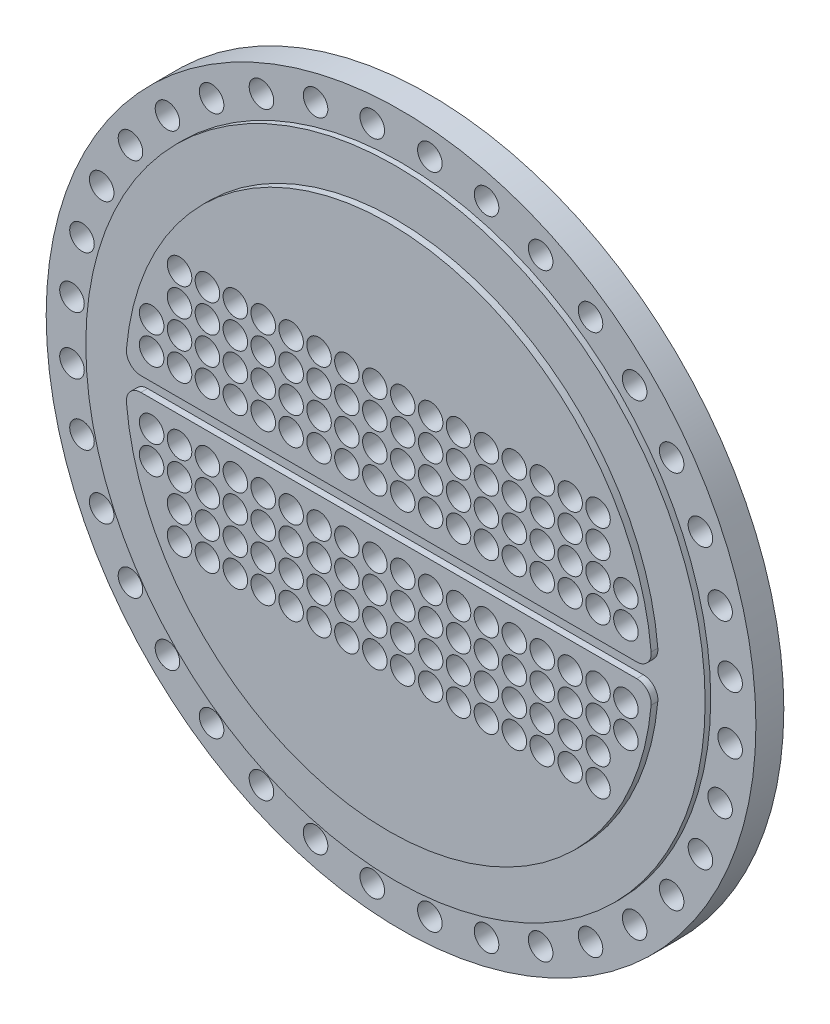
from build123d import *

# Parameters (mm, degrees)
SKETCH1_R                                  = 236
BOSS_EXTRUDE1_DEPTH                        = 23.5
SKETCH1_3_R                                = 318
SKETCH1_3_R_2                              = 277.5
BOSS_EXTRUDE2_DEPTH                        = 12.5
SKETCH1_4_R                                = 277.5
SKETCH1_4_R_2                              = 236
BOSS_EXTRUDE3_DEPTH                        = 17.5
SKETCH2_W                                  = 507.95511498
SKETCH2_H                                  = 13
CUT_EXTRUDE1_DEPTH                         = 6
FILLET1_R                                  = 13
SKETCH3_R                                  = 11
CUT_EXTRUDE2_DEPTH                         = 452.158508731
CIRPATTERN1_COUNT                          = 6
SKETCH11_R                                 = 11
CUT_EXTRUDE3_DEPTH                         = 453.169216113
MIRROR1_AT_THE_SECOND_PLANE_COPY_1_SKETC_R = 11
MIRROR1_AT_THE_SECOND_PLANE_COPY_1_DEPTH   = 453.169216113


with BuildPart() as part:
    # Sketch1 → Boss-Extrude1 (new, symmetric)
    with BuildSketch(Plane.XY):
        Circle(SKETCH1_R)
    extrude(amount=BOSS_EXTRUDE1_DEPTH, both=True)



with BuildPart() as body_2:
    # Sketch1<3> → Boss-Extrude2 (new, symmetric)
    with BuildSketch(Plane.XY):
        Circle(SKETCH1_3_R)
        Circle(SKETCH1_3_R_2, mode=Mode.SUBTRACT)
    extrude(amount=BOSS_EXTRUDE2_DEPTH, both=True)


with BuildPart() as part_1:
    add(part.part)

    add(body_2.part)  # Boss-Extrude3 merges body 2
    # Sketch1<4> → Boss-Extrude3 (add, symmetric)
    with BuildSketch(Plane.XY):
        Circle(SKETCH1_4_R)
        Circle(SKETCH1_4_R_2, mode=Mode.SUBTRACT)
    extrude(amount=BOSS_EXTRUDE3_DEPTH, both=True)

    # Sketch2 → Cut-Extrude1 (cut)
    with BuildSketch(Plane.XY.offset(23.5)):
        Rectangle(SKETCH2_W, SKETCH2_H)
    extrude(amount=-CUT_EXTRUDE1_DEPTH, mode=Mode.SUBTRACT)

    # Fillet1
    fillet1_edges = [part_1.edges().sort_by_distance(p)[0] for p in [
        (-235.910470306, -6.5, 20.5),
        (235.910470306, -6.5, 20.5),
        (235.910470306, 6.5, 20.5),
        (-235.910470306, 6.5, 20.5),
    ]]
    fillet(fillet1_edges, radius=FILLET1_R)

    # Sketch3 → Cut-Extrude2 (cut, through all)
    with BuildSketch(Plane.XY.offset(12.5)):
        with Locations((25.798099853, 294.873630635)):
            Circle(SKETCH3_R)
        with Locations((76.61043735, 285.914044582)):
            Circle(SKETCH3_R)
        with Locations((125.095005475, 268.267104963)):
            Circle(SKETCH3_R)
        with Locations((169.77862516, 242.46900511)):
            Circle(SKETCH3_R)
        with Locations((209.303607231, 209.303607231)):
            Circle(SKETCH3_R)
        with Locations((242.46900511, 169.77862516)):
            Circle(SKETCH3_R)
        with Locations((268.267104963, 125.095005475)):
            Circle(SKETCH3_R)
        with Locations((285.914044582, 76.61043735)):
            Circle(SKETCH3_R)
        with Locations((294.873630635, 25.798099853)):
            Circle(SKETCH3_R)
        with Locations((294.873630635, -25.798099853)):
            Circle(SKETCH3_R)
        with Locations((285.914044582, -76.61043735)):
            Circle(SKETCH3_R)
        with Locations((268.267104963, -125.095005475)):
            Circle(SKETCH3_R)
        with Locations((242.46900511, -169.77862516)):
            Circle(SKETCH3_R)
        with Locations((209.303607231, -209.303607231)):
            Circle(SKETCH3_R)
        with Locations((169.77862516, -242.46900511)):
            Circle(SKETCH3_R)
        with Locations((125.095005475, -268.267104963)):
            Circle(SKETCH3_R)
        with Locations((76.61043735, -285.914044582)):
            Circle(SKETCH3_R)
        with Locations((25.798099853, -294.873630635)):
            Circle(SKETCH3_R)
        with Locations((-25.798099853, -294.873630635)):
            Circle(SKETCH3_R)
        with Locations((-76.61043735, -285.914044582)):
            Circle(SKETCH3_R)
        with Locations((-125.095005475, -268.267104963)):
            Circle(SKETCH3_R)
        with Locations((-169.77862516, -242.46900511)):
            Circle(SKETCH3_R)
        with Locations((-209.303607231, -209.303607231)):
            Circle(SKETCH3_R)
        with Locations((-242.46900511, -169.77862516)):
            Circle(SKETCH3_R)
        with Locations((-268.267104963, -125.095005475)):
            Circle(SKETCH3_R)
        with Locations((-285.914044582, -76.61043735)):
            Circle(SKETCH3_R)
        with Locations((-294.873630635, -25.798099853)):
            Circle(SKETCH3_R)
        with Locations((-294.873630635, 25.798099853)):
            Circle(SKETCH3_R)
        with Locations((-285.914044582, 76.61043735)):
            Circle(SKETCH3_R)
        with Locations((-268.267104963, 125.095005475)):
            Circle(SKETCH3_R)
        with Locations((-242.46900511, 169.77862516)):
            Circle(SKETCH3_R)
        with Locations((-209.303607231, 209.303607231)):
            Circle(SKETCH3_R)
        with Locations((-169.77862516, 242.46900511)):
            Circle(SKETCH3_R)
        with Locations((-125.095005475, 268.267104963)):
            Circle(SKETCH3_R)
        with Locations((-76.61043735, 285.914044582)):
            Circle(SKETCH3_R)
        with Locations((-25.798099853, 294.873630635)):
            Circle(SKETCH3_R)
    extrude(amount=-CUT_EXTRUDE2_DEPTH, mode=Mode.SUBTRACT)

    # Sketch10 → 3/8-16 Tapped Hole1 (revolve, cut)
    with BuildSketch(Plane(origin=(95, -164.544826719, -23.5), x_dir=(0, 1, 0), z_dir=(1, 0, 0))):
        Polygon((0, 0), (0, 34.384665582), (3.96875, 32), (3.96875, 25), (4.7625, 25), (4.7625, 0), align=None)
    f_3_8_16_tapped_hole1 = revolve(axis=Axis((95, -164.544826719, -29.85), (0, 0, 1)), mode=Mode.SUBTRACT)

    # CirPattern1: 3/8-16 Tapped Hole1 ×6 about axis
    cirpattern1_axis = Axis((-0.038703164, 0.067035847, 0), (0, 0, 1))
    for i in range(1, CIRPATTERN1_COUNT):
        add(f_3_8_16_tapped_hole1.rotate(cirpattern1_axis, i * 360 / CIRPATTERN1_COUNT), mode=Mode.SUBTRACT)

    # Sketch11 → Cut-Extrude3 (cut, through all)
    with BuildSketch(Plane.XY.offset(23.5)):
        with Locations((12.5, -30)):
            Circle(SKETCH11_R)
        with Locations((12.5, -55)):
            Circle(SKETCH11_R)
        with Locations((12.5, -80)):
            Circle(SKETCH11_R)
        with Locations((12.5, -105)):
            Circle(SKETCH11_R)
        with Locations((37.5, -30)):
            Circle(SKETCH11_R)
        with Locations((37.5, -55)):
            Circle(SKETCH11_R)
        with Locations((62.5, -30)):
            Circle(SKETCH11_R)
        with Locations((62.5, -55)):
            Circle(SKETCH11_R)
        with Locations((87.5, -30)):
            Circle(SKETCH11_R)
        with Locations((87.5, -55)):
            Circle(SKETCH11_R)
        with Locations((112.5, -30)):
            Circle(SKETCH11_R)
        with Locations((112.5, -55)):
            Circle(SKETCH11_R)
        with Locations((137.5, -30)):
            Circle(SKETCH11_R)
        with Locations((137.5, -55)):
            Circle(SKETCH11_R)
        with Locations((162.5, -30)):
            Circle(SKETCH11_R)
        with Locations((162.5, -55)):
            Circle(SKETCH11_R)
        with Locations((187.5, -30)):
            Circle(SKETCH11_R)
        with Locations((187.5, -55)):
            Circle(SKETCH11_R)
        with Locations((212.5, -30)):
            Circle(SKETCH11_R)
        with Locations((212.5, -55)):
            Circle(SKETCH11_R)
        with Locations((37.5, -80)):
            Circle(SKETCH11_R)
        with Locations((37.5, -105)):
            Circle(SKETCH11_R)
        with Locations((62.5, -80)):
            Circle(SKETCH11_R)
        with Locations((62.5, -105)):
            Circle(SKETCH11_R)
        with Locations((87.5, -80)):
            Circle(SKETCH11_R)
        with Locations((87.5, -105)):
            Circle(SKETCH11_R)
        with Locations((112.5, -80)):
            Circle(SKETCH11_R)
        with Locations((112.5, -105)):
            Circle(SKETCH11_R)
        with Locations((137.5, -80)):
            Circle(SKETCH11_R)
        with Locations((137.5, -105)):
            Circle(SKETCH11_R)
        with Locations((162.5, -80)):
            Circle(SKETCH11_R)
        with Locations((162.5, -105)):
            Circle(SKETCH11_R)
        with Locations((187.5, -80)):
            Circle(SKETCH11_R)
        with Locations((187.5, -105)):
            Circle(SKETCH11_R)
    cut_extrude3 = extrude(amount=-CUT_EXTRUDE3_DEPTH, mode=Mode.SUBTRACT)

    # Mirror1: Cut-Extrude3 across plane
    add(cut_extrude3.mirror(Plane.ZX), mode=Mode.SUBTRACT)

    # Mirror1 at the second plane: Cut-Extrude3 across plane
    add(cut_extrude3.mirror(Plane(origin=(0, 0, 0), x_dir=(0, 0, 1), z_dir=(1, 0, 0))), mode=Mode.SUBTRACT)

    # Mirror1 at the second plane copy 1 sketc → Mirror1 at the second plane copy 1 (cut, through all)
    with BuildSketch(Plane(origin=(0, 0, 23.5), x_dir=(-1, 0, 0), z_dir=(0, 0, 1))):
        with Locations((12.5, -30)):
            Circle(MIRROR1_AT_THE_SECOND_PLANE_COPY_1_SKETC_R)
        with Locations((12.5, -55)):
            Circle(MIRROR1_AT_THE_SECOND_PLANE_COPY_1_SKETC_R)
        with Locations((12.5, -80)):
            Circle(MIRROR1_AT_THE_SECOND_PLANE_COPY_1_SKETC_R)
        with Locations((12.5, -105)):
            Circle(MIRROR1_AT_THE_SECOND_PLANE_COPY_1_SKETC_R)
        with Locations((37.5, -30)):
            Circle(MIRROR1_AT_THE_SECOND_PLANE_COPY_1_SKETC_R)
        with Locations((37.5, -55)):
            Circle(MIRROR1_AT_THE_SECOND_PLANE_COPY_1_SKETC_R)
        with Locations((62.5, -30)):
            Circle(MIRROR1_AT_THE_SECOND_PLANE_COPY_1_SKETC_R)
        with Locations((62.5, -55)):
            Circle(MIRROR1_AT_THE_SECOND_PLANE_COPY_1_SKETC_R)
        with Locations((87.5, -30)):
            Circle(MIRROR1_AT_THE_SECOND_PLANE_COPY_1_SKETC_R)
        with Locations((87.5, -55)):
            Circle(MIRROR1_AT_THE_SECOND_PLANE_COPY_1_SKETC_R)
        with Locations((112.5, -30)):
            Circle(MIRROR1_AT_THE_SECOND_PLANE_COPY_1_SKETC_R)
        with Locations((112.5, -55)):
            Circle(MIRROR1_AT_THE_SECOND_PLANE_COPY_1_SKETC_R)
        with Locations((137.5, -30)):
            Circle(MIRROR1_AT_THE_SECOND_PLANE_COPY_1_SKETC_R)
        with Locations((137.5, -55)):
            Circle(MIRROR1_AT_THE_SECOND_PLANE_COPY_1_SKETC_R)
        with Locations((162.5, -30)):
            Circle(MIRROR1_AT_THE_SECOND_PLANE_COPY_1_SKETC_R)
        with Locations((162.5, -55)):
            Circle(MIRROR1_AT_THE_SECOND_PLANE_COPY_1_SKETC_R)
        with Locations((187.5, -30)):
            Circle(MIRROR1_AT_THE_SECOND_PLANE_COPY_1_SKETC_R)
        with Locations((187.5, -55)):
            Circle(MIRROR1_AT_THE_SECOND_PLANE_COPY_1_SKETC_R)
        with Locations((212.5, -30)):
            Circle(MIRROR1_AT_THE_SECOND_PLANE_COPY_1_SKETC_R)
        with Locations((212.5, -55)):
            Circle(MIRROR1_AT_THE_SECOND_PLANE_COPY_1_SKETC_R)
        with Locations((37.5, -80)):
            Circle(MIRROR1_AT_THE_SECOND_PLANE_COPY_1_SKETC_R)
        with Locations((37.5, -105)):
            Circle(MIRROR1_AT_THE_SECOND_PLANE_COPY_1_SKETC_R)
        with Locations((62.5, -80)):
            Circle(MIRROR1_AT_THE_SECOND_PLANE_COPY_1_SKETC_R)
        with Locations((62.5, -105)):
            Circle(MIRROR1_AT_THE_SECOND_PLANE_COPY_1_SKETC_R)
        with Locations((87.5, -80)):
            Circle(MIRROR1_AT_THE_SECOND_PLANE_COPY_1_SKETC_R)
        with Locations((87.5, -105)):
            Circle(MIRROR1_AT_THE_SECOND_PLANE_COPY_1_SKETC_R)
        with Locations((112.5, -80)):
            Circle(MIRROR1_AT_THE_SECOND_PLANE_COPY_1_SKETC_R)
        with Locations((112.5, -105)):
            Circle(MIRROR1_AT_THE_SECOND_PLANE_COPY_1_SKETC_R)
        with Locations((137.5, -80)):
            Circle(MIRROR1_AT_THE_SECOND_PLANE_COPY_1_SKETC_R)
        with Locations((137.5, -105)):
            Circle(MIRROR1_AT_THE_SECOND_PLANE_COPY_1_SKETC_R)
        with Locations((162.5, -80)):
            Circle(MIRROR1_AT_THE_SECOND_PLANE_COPY_1_SKETC_R)
        with Locations((162.5, -105)):
            Circle(MIRROR1_AT_THE_SECOND_PLANE_COPY_1_SKETC_R)
        with Locations((187.5, -80)):
            Circle(MIRROR1_AT_THE_SECOND_PLANE_COPY_1_SKETC_R)
        with Locations((187.5, -105)):
            Circle(MIRROR1_AT_THE_SECOND_PLANE_COPY_1_SKETC_R)
    extrude(amount=-MIRROR1_AT_THE_SECOND_PLANE_COPY_1_DEPTH, mode=Mode.SUBTRACT)


solid = part_1.part
